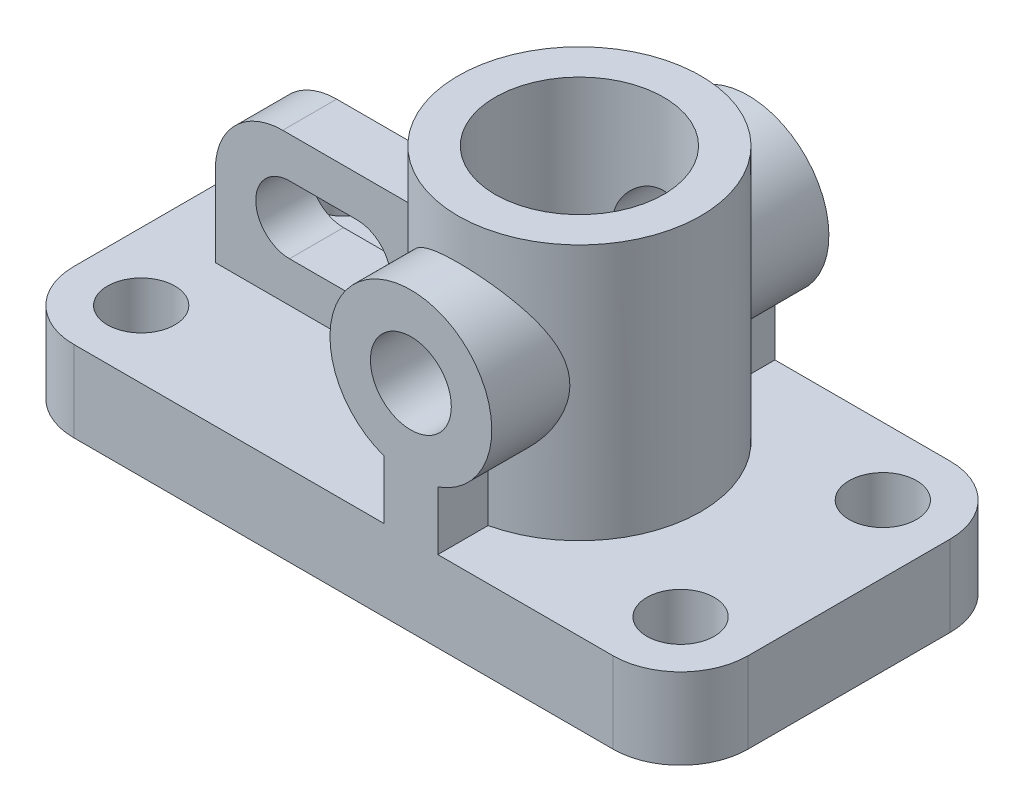
from build123d import *

# Parameters (mm, degrees)
EXTRUDE_1_DEPTH             = 12
SKETCH_2_W                  = 18
SKETCH_2_H                  = 50
EXTRUDE_3_REACH             = 84.006
SKETCH_3_R                  = 12
EXTRUDE_3_DIRECTION_2_REACH = 84.006
EXTRUDE_4_DEPTH             = 4
RIB_1_REACH                 = 84.006
SKETCH_5_WALL_W             = 174.012194852
SKETCH_5_WALL_H             = 8
HOLE_WIZARD_10_0_10_1_D     = 10
PATTERN_LINEAR_2_COUNT      = 2
PATTERN_LINEAR_2_PITCH      = 80
PATTERN_LINEAR_2_COUNT_DIR2 = 2
PATTERN_LINEAR_2_PITCH_DIR2 = 30
CUT_EXTRUDE_1_DEPTH         = 84.312664198
HOLE_WIZARD_25_0_25_1_D     = 25
HOLE_WIZARD_12_0_12_1_D     = 12


with BuildPart() as part:
    # 草图1 → 凸台-拉伸1 (new body)
    with BuildSketch(Plane(origin=(0, 0, 0), x_dir=(1, 0, 0), z_dir=(0, 1, 0))):
        with BuildLine():
            Line((-50, -25), (30, -25))
            ThreePointArc((30, -25), (37.071067812, -22.071067812), (40, -15))
            Line((40, -15), (40, 15))
            ThreePointArc((40, 15), (37.071067812, 22.071067812), (30, 25))
            Line((30, 25), (-50, 25))
            ThreePointArc((-50, 25), (-57.071067812, 22.071067812), (-60, 15))
            Line((-60, 15), (-60, -15))
            ThreePointArc((-60, -15), (-57.071067812, -22.071067812), (-50, -25))
        make_face()
    extrude(amount=EXTRUDE_1_DEPTH)

    # 草图2 → 旋转1 (revolve)
    with BuildSketch(Plane.XY, mode=Mode.PRIVATE) as revolve_1_sk:
        with Locations((9, 25)):
            Rectangle(SKETCH_2_W, SKETCH_2_H)
    revolve(revolve_1_sk.sketch.rotate(Axis((0, 42.98545342, 0), (0, -1, 0)), 90), axis=Axis((0, 42.98545342, 0), (0, -1, 0)))

    # 凸台-拉伸3: up to this face of the body (flat: up to its plane)
    extrude_3_end = Plane(part.part.faces().sort_by_distance((-10, 6, 25))[0])
    # 草图3 → 凸台-拉伸3 (add, up to the picked face)
    with BuildSketch(Plane.XY, mode=Mode.PRIVATE) as extrude_3_sk1:
        with Locations(Location((0, 32, 0), (0, 0, 180))):
            Circle(SKETCH_3_R)
    extrude_3_tool1 = split(extrude(extrude_3_sk1.sketch, amount=EXTRUDE_3_REACH, mode=Mode.PRIVATE), bisect_by=extrude_3_end, keep=Keep.BOTH, mode=Mode.PRIVATE)
    add(extrude_3_tool1.solids().sort_by(Axis((0, 32, 0), (0, 0, 1)))[0])

    # 凸台-拉伸3 direction 2: up to this face of the body (flat: up to its plane)
    extrude_3_direction_2_end = Plane(part.part.faces().sort_by_distance((-10, 6, -25))[0])
    # 草图3 → 凸台-拉伸3 direction 2 (add, up to the picked face)
    with BuildSketch(Plane.XY, mode=Mode.PRIVATE) as extrude_3_direction_2_sk1:
        with Locations(Location((0, 32, 0), (0, 0, 180))):
            Circle(SKETCH_3_R)
    extrude_3_direction_2_tool1 = split(extrude(extrude_3_direction_2_sk1.sketch, amount=-EXTRUDE_3_DIRECTION_2_REACH, mode=Mode.PRIVATE), bisect_by=extrude_3_direction_2_end, keep=Keep.BOTH, mode=Mode.PRIVATE)
    add(extrude_3_direction_2_tool1.solids().sort_by(Axis((0, 32, 0), (0, 0, -1)))[0])

    # 草图4 → 凸台-拉伸4 (add, symmetric)
    with BuildSketch(Plane.XY):
        with BuildLine():
            Line((-40, 34), (0, 34))
            Line((0, 34), (0, 12))
            Line((0, 12), (-50, 12))
            Line((-50, 12), (-50, 24))
            ThreePointArc((-50, 24), (-47.071067812, 31.071067812), (-40, 34))
        make_face()
    extrude(amount=EXTRUDE_4_DEPTH, both=True)

    # 草图5 wall → 筋1 (add, up to next)
    with BuildSketch(Plane(origin=(0, 16, 25), x_dir=(0, -1, 0), z_dir=(0, 0, -1)), mode=Mode.PRIVATE) as rib_1_sk1:
        Rectangle(SKETCH_5_WALL_W, SKETCH_5_WALL_H)
    rib_1_tool1 = extrude(rib_1_sk1.sketch, amount=RIB_1_REACH, mode=Mode.PRIVATE) - part.part
    rib_1 = rib_1_tool1.solids().sort_by_distance((0, 16, 25))[0]
    add(rib_1)

    # 镜向1: 筋1 across plane
    add(rib_1.mirror(Plane.XY))

    # Ø10.0 (10) 直径孔1 (through all)
    with Locations(Plane(origin=(0, 12, 0), x_dir=(1, 0, 0), z_dir=(0, 1, 0))):
        with Locations((-50, -15)):
            hole_wizard_10_0_10_1 = Hole(HOLE_WIZARD_10_0_10_1_D / 2)

    # 阵列(线性)2: Hole Wizard 10.0 _10_ _1 2 × 2
    with Locations(*[(i * PATTERN_LINEAR_2_PITCH, 0, -j * PATTERN_LINEAR_2_PITCH_DIR2) for i in range(PATTERN_LINEAR_2_COUNT) for j in range(PATTERN_LINEAR_2_COUNT_DIR2) if (i, j) != (0, 0)]):
        add(hole_wizard_10_0_10_1, mode=Mode.SUBTRACT)

    # 草图8 → 切除-拉伸1 (cut, through all)
    with BuildSketch(Plane.XY.offset(4)):
        with BuildLine():
            Line((-39, 18), (-29, 18))
            ThreePointArc((-29, 18), (-24, 23), (-29, 28))
            Line((-29, 28), (-39, 28))
            ThreePointArc((-39, 28), (-44, 23), (-39, 18))
        make_face()
    extrude(amount=-CUT_EXTRUDE_1_DEPTH, mode=Mode.SUBTRACT)

    # Ø25.0 (25) 直径孔1 (through all)
    with Locations(Plane(origin=(0, 50, 0), x_dir=(1, 0, 0), z_dir=(0, 1, 0))):
        with Locations((0, 0)):
            Hole(HOLE_WIZARD_25_0_25_1_D / 2)

    # Ø12.0 (12) 直径孔1 (through all)
    with Locations(Plane.XY.offset(25)):
        with Locations((0, 32)):
            Hole(HOLE_WIZARD_12_0_12_1_D / 2)


solid = part.part
